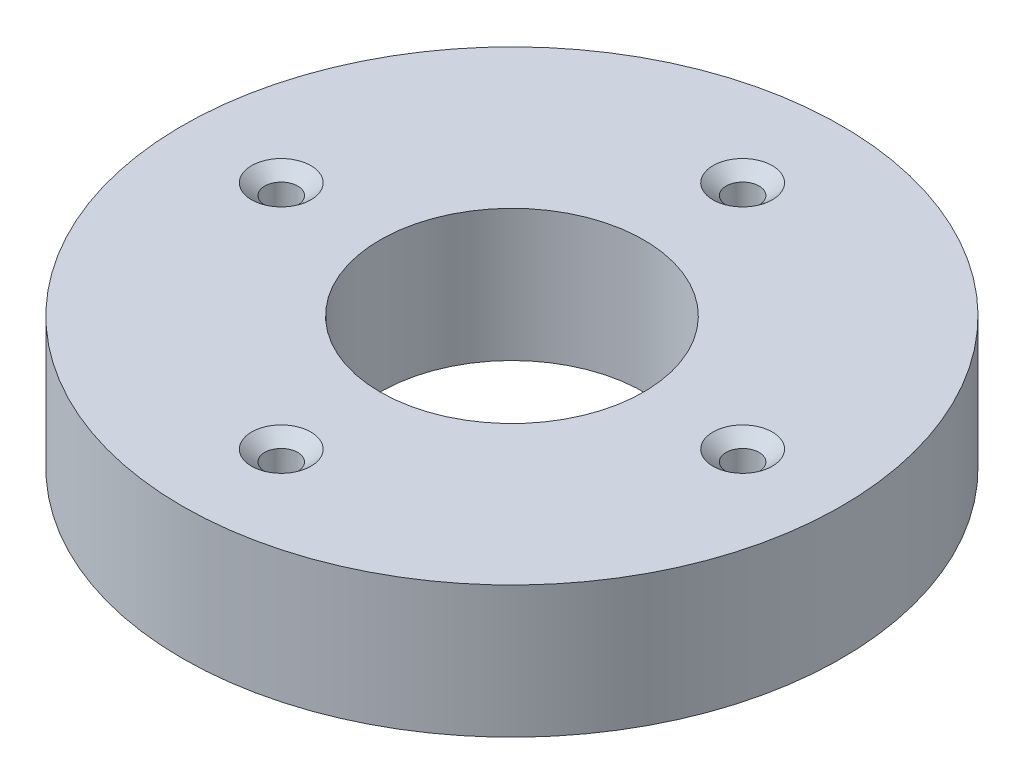
from build123d import *

# Parameters (mm, degrees)
SKETCH1_R                                = 15.875
BOSS_EXTRUDE1_DEPTH                      = 6.35
SKETCH2_R                                = 6.35
CUT_EXTRUDE1_DEPTH                       = 24.3313898
F_1_16_0_0625_DIAMETER_HOLE1_D           = 1.5875
F_1_16_0_0625_DIAMETER_HOLE1_CSINK_D     = 2.8575
F_1_16_0_0625_DIAMETER_HOLE1_CSINK_ANGLE = 100
CIRPATTERN1_COUNT                        = 2
CIRPATTERN2_COUNT                        = 2


with BuildPart() as part:
    # Sketch1 → Boss-Extrude1 (new body)
    with BuildSketch(Plane(origin=(0, 0, 0), x_dir=(1, 0, 0), z_dir=(0, 1, 0))):
        with Locations(Location((0, 0, 0), (0, 0, 270))):
            Circle(SKETCH1_R)
    extrude(amount=BOSS_EXTRUDE1_DEPTH)

    # Sketch2 → Cut-Extrude1 (cut, through all)
    with BuildSketch(Plane(origin=(0, 6.35, 0), x_dir=(1, 0, 0), z_dir=(0, 1, 0))):
        with Locations(Location((0, 0, 0), (0, 0, 270))):
            Circle(SKETCH2_R)
    extrude(amount=-CUT_EXTRUDE1_DEPTH, mode=Mode.SUBTRACT)

    # 1/16 (0.0625) Diameter Hole1 (through all)
    with Locations(Plane(origin=(0, 6.35, 0), x_dir=(1, 0, 0), z_dir=(0, 1, 0))):
        with Locations((0, 11.1125)):
            f_1_16_0_0625_diameter_hole1 = CounterSinkHole(F_1_16_0_0625_DIAMETER_HOLE1_D / 2, F_1_16_0_0625_DIAMETER_HOLE1_CSINK_D / 2, counter_sink_angle=F_1_16_0_0625_DIAMETER_HOLE1_CSINK_ANGLE)

    # CirPattern1: 1/16 (0.0625) Diameter Hole1 ×2 about axis
    cirpattern1_axis = Axis((0, 0, 0), (0, 1, 0))
    for i in range(1, CIRPATTERN1_COUNT):
        add(f_1_16_0_0625_diameter_hole1.rotate(cirpattern1_axis, i * 360 / CIRPATTERN1_COUNT), mode=Mode.SUBTRACT)

    # Sketch10 → 1/16 (0.0625) Diameter Hole2 (revolve, cut)
    with BuildSketch(Plane(origin=(11.1125, 6.35, 0), x_dir=(0, 0, 1), z_dir=(1, 0, 0))):
        Polygon((0, 0), (0, 4.286933116), (0.79375, 3.81), (0.79375, 0.532828266), (1.42875, 0), align=None)
    f_1_16_0_0625_diameter_hole2 = revolve(axis=Axis((11.1125, 12.7, 0), (0, -1, 0)), mode=Mode.SUBTRACT)

    # CirPattern2: 1/16 (0.0625) Diameter Hole2 ×2 about axis
    cirpattern2_axis = Axis((0, 0, 0), (0, 1, 0))
    for i in range(1, CIRPATTERN2_COUNT):
        add(f_1_16_0_0625_diameter_hole2.rotate(cirpattern2_axis, i * 360 / CIRPATTERN2_COUNT), mode=Mode.SUBTRACT)


solid = part.part
